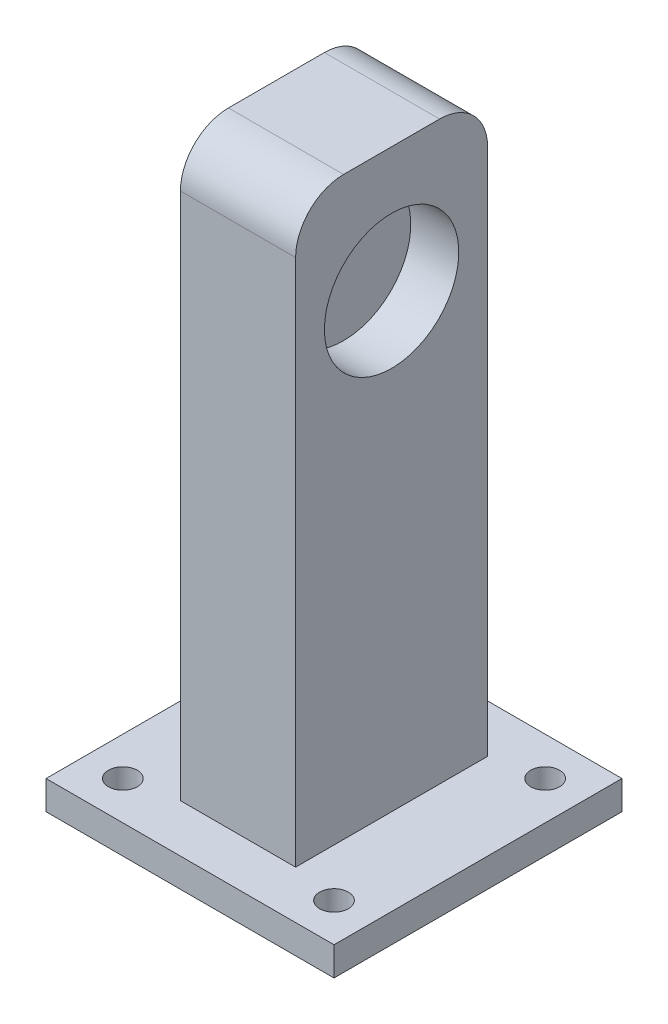
from build123d import *

# Parameters (mm, degrees)
SKETCH_4_W          = 30
SKETCH_4_H          = 3
EXTRUDE_3_DEPTH     = 30
EXTRUDE_START       = -9
SKETCH_5_W          = 20
SKETCH_5_H          = 60
EXTRUDE_4_DEPTH     = 12
SKETCH_6_R          = 7
CUT_EXTRUDE_1_DEPTH = 5
CUT_EXTRUDE_START   = -7
SKETCH_6_5_R        = 7
CUT_EXTRUDE_3_DEPTH = 5
SKETCH_7_R          = 1.5
CUT_EXTRUDE_4_DEPTH = 74.484692283
FILLET_1_R          = 5


with BuildPart() as part:
    # 草图4 → 凸台-拉伸3 (new body)
    with BuildSketch(Plane.XY):
        with Locations((15, 1.5)):
            Rectangle(SKETCH_4_W, SKETCH_4_H)
    extrude(amount=EXTRUDE_3_DEPTH)

    # 草图5 → 凸台-拉伸4 (add)
    with BuildSketch(Plane.ZY.offset(EXTRUDE_START)):
        with Locations((15, 33)):
            Rectangle(SKETCH_5_W, SKETCH_5_H)
    extrude(amount=-EXTRUDE_4_DEPTH)

    # 草图6 → 切除-拉伸1 (cut)
    with BuildSketch(Plane.ZY.offset(-9)):
        with Locations((15, 50)):
            Circle(SKETCH_6_R)
    extrude(amount=-CUT_EXTRUDE_1_DEPTH, mode=Mode.SUBTRACT)

    # 草图6<5> → 切除-拉伸3 (cut)
    with BuildSketch(Plane.ZY.offset(-9).offset(CUT_EXTRUDE_START)):
        with Locations((15, 50)):
            Circle(SKETCH_6_5_R)
    extrude(amount=-CUT_EXTRUDE_3_DEPTH, mode=Mode.SUBTRACT)

    # 草图7 → 切除-拉伸4 (cut, through all)
    with BuildSketch(Plane(origin=(0, 3, 0), x_dir=(1, 0, 0), z_dir=(0, 1, 0))):
        with Locations((4, -4)):
            Circle(SKETCH_7_R)
        with Locations((26, -4)):
            Circle(SKETCH_7_R)
        with Locations((26, -26)):
            Circle(SKETCH_7_R)
        with Locations((4, -26)):
            Circle(SKETCH_7_R)
    extrude(amount=-CUT_EXTRUDE_4_DEPTH, mode=Mode.SUBTRACT)

    # 圆角1
    fillet_1_edges = [part.edges().sort_by_distance(p)[0] for p in [
        (15, 63, 25),
        (15, 63, 5),
    ]]
    fillet(fillet_1_edges, radius=FILLET_1_R)


solid = part.part
